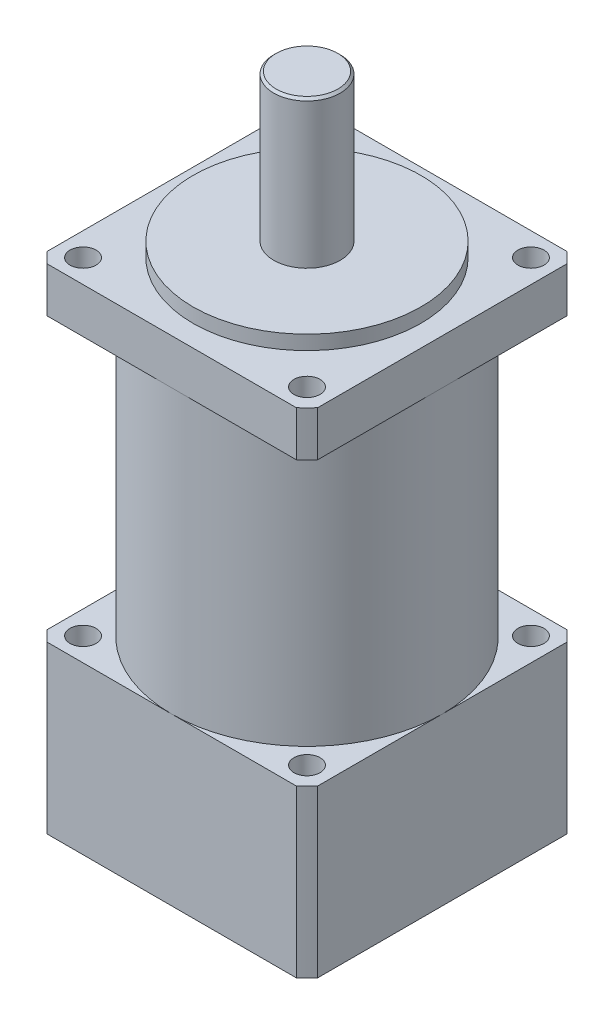
from build123d import *

# Parameters (mm, degrees)
EXTRUDE_1_DEPTH     = 35
SKETCH_2_R          = 28.5
EXTRUDE_2_DEPTH     = 69
EXTRUDE_START       = -9.5
EXTRUDE_3_DEPTH     = 9.5
SKETCH_4_R          = 24
EXTRUDE_4_DEPTH     = 3
SKETCH_5_R          = 7
EXTRUDE_5_DEPTH     = 31
SKETCH_6_R          = 2.75
CUT_EXTRUDE_1_DEPTH = 297
SKETCH_7_R          = 21
CUT_EXTRUDE_2_DEPTH = 22
EXTRUDE_6_DEPTH     = 17
CHAMFER_1_SIZE      = 0.5


with BuildPart() as part:
    # 草图1 → 凸台-拉伸1 (new body)
    with BuildSketch(Plane(origin=(0, 0, 0), x_dir=(1, 0, 0), z_dir=(0, 1, 0))):
        with BuildLine():
            Line((26.254761473, 28.5), (-26.254761473, 28.5))
            ThreePointArc((-26.254761473, 28.5), (-27.400387771, 27.400387771), (-28.5, 26.254761473))
            Line((-28.5, 26.254761473), (-28.5, -26.254761473))
            ThreePointArc((-28.5, -26.254761473), (-27.400387771, -27.400387771), (-26.254761473, -28.5))
            Line((-26.254761473, -28.5), (26.254761473, -28.5))
            ThreePointArc((26.254761473, -28.5), (27.400387771, -27.400387771), (28.5, -26.254761473))
            Line((28.5, -26.254761473), (28.5, 26.254761473))
            ThreePointArc((28.5, 26.254761473), (27.400387771, 27.400387771), (26.254761473, 28.5))
        make_face()
    extrude(amount=EXTRUDE_1_DEPTH)

    # 草图2 → 凸台-拉伸2 (add)
    with BuildSketch(Plane(origin=(0, 35, 0), x_dir=(1, 0, 0), z_dir=(0, 1, 0))):
        with Locations(Location((0, 0, 0), (0, 0, 270))):
            Circle(SKETCH_2_R)
    extrude(amount=EXTRUDE_2_DEPTH)

    # 草图3 → 凸台-拉伸3 (add)
    with BuildSketch(Plane(origin=(0, 104, 0), x_dir=(1, 0, 0), z_dir=(0, 1, 0)).offset(EXTRUDE_START)):
        with BuildLine():
            Line((-26.254761473, -28.5), (26.254761473, -28.5))
            ThreePointArc((26.254761473, -28.5), (27.400387771, -27.400387771), (28.5, -26.254761473))
            Line((28.5, -26.254761473), (28.5, 26.254761473))
            ThreePointArc((28.5, 26.254761473), (27.400387771, 27.400387771), (26.254761473, 28.5))
            Line((26.254761473, 28.5), (-26.254761473, 28.5))
            ThreePointArc((-26.254761473, 28.5), (-27.400387771, 27.400387771), (-28.5, 26.254761473))
            Line((-28.5, 26.254761473), (-28.5, -26.254761473))
            ThreePointArc((-28.5, -26.254761473), (-27.400387771, -27.400387771), (-26.254761473, -28.5))
        make_face()
    extrude(amount=EXTRUDE_3_DEPTH)

    # 草图4 → 凸台-拉伸4 (add)
    with BuildSketch(Plane(origin=(0, 104, 0), x_dir=(1, 0, 0), z_dir=(0, 1, 0))):
        with Locations(Location((0, 0, 0), (0, 0, 270))):
            Circle(SKETCH_4_R)
    extrude(amount=EXTRUDE_4_DEPTH)

    # 草图5 → 凸台-拉伸5 (add)
    with BuildSketch(Plane(origin=(0, 107, 0), x_dir=(1, 0, 0), z_dir=(0, 1, 0))):
        with Locations(Location((0, 0, 0), (0, 0, 270))):
            Circle(SKETCH_5_R)
    extrude(amount=EXTRUDE_5_DEPTH)

    # 草图6 → 切除-拉伸1 (cut)
    with BuildSketch(Plane.XZ):
        with Locations(Location((-23.582011153, 23.582011153, 0), (0, 0, 270))):
            Circle(SKETCH_6_R)
        with Locations(Location((23.582011153, 23.582011153, 0), (0, 0, 270))):
            Circle(SKETCH_6_R)
        with Locations(Location((23.582011153, -23.582011153, 0), (0, 0, 270))):
            Circle(SKETCH_6_R)
        with Locations(Location((-23.582011153, -23.582011153, 0), (0, 0, 270))):
            Circle(SKETCH_6_R)
    extrude(amount=-CUT_EXTRUDE_1_DEPTH, mode=Mode.SUBTRACT)

    # 草图7 → 切除-拉伸2 (cut)
    with BuildSketch(Plane.XZ):
        with Locations(Location((0, 0, 0), (0, 0, 270))):
            Circle(SKETCH_7_R)
    extrude(amount=-CUT_EXTRUDE_2_DEPTH, mode=Mode.SUBTRACT)

    # 草图8 → 凸台-拉伸6 (add)
    with BuildSketch(Plane.XZ.offset(-22)):
        with BuildLine():
            Line((-0.8, 3.919183588), (-0.8, 19.033194687))
            ThreePointArc((-0.8, 19.033194687), (-13.184507954, -13.750318178), (19.05, 0))
            ThreePointArc((19.05, 0), (13.750318178, 13.184507954), (0.8, 19.033194687))
            Line((0.8, 19.033194687), (0.8, 3.919183588))
            ThreePointArc((0.8, 3.919183588), (3.098386677, 2.529822128), (4, 0))
            ThreePointArc((4, 0), (-2.529822128, -3.098386677), (-0.8, 3.919183588))
        make_face()
    extrude(amount=EXTRUDE_6_DEPTH)

    # 倒角1
    chamfer_1_edges = [part.edges().sort_by_distance(p)[0] for p in [
        (0, 138, -7),
    ]]
    chamfer(chamfer_1_edges, length=CHAMFER_1_SIZE)


solid = part.part
